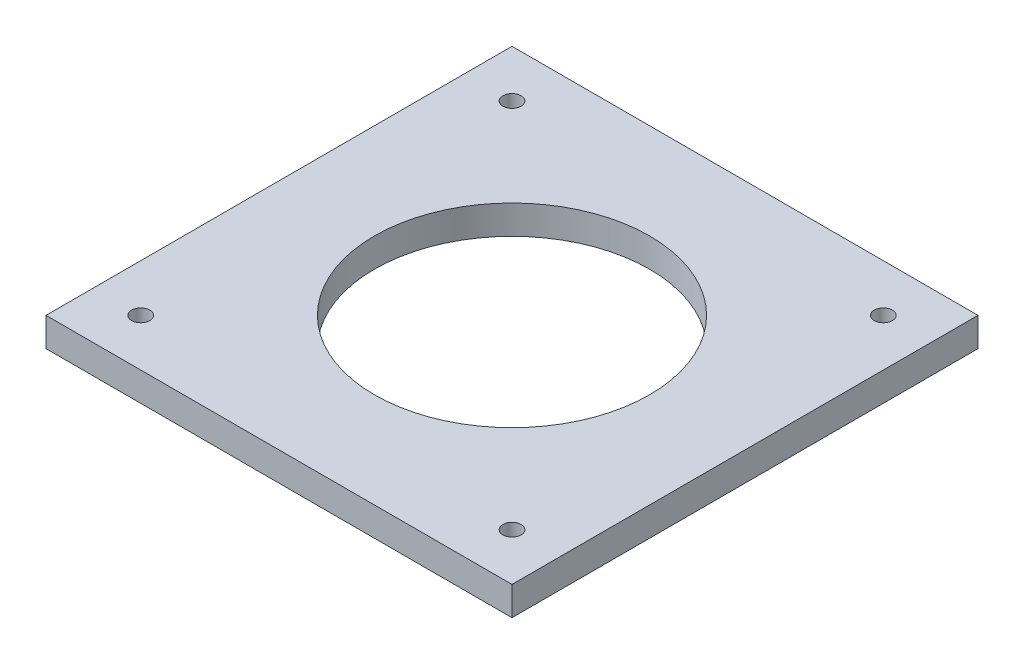
from build123d import *

# Parameters (mm, degrees)
SKETCH1_W           = 101.6
SKETCH1_H           = 101.6
SKETCH1_R           = 30
SKETCH1_R_2         = 1.985
BOSS_EXTRUDE1_DEPTH = 6.29


with BuildPart() as part:
    # Sketch1 → Boss-Extrude1 (new body)
    with BuildSketch(Plane(origin=(0, 0, 0), x_dir=(1, 0, 0), z_dir=(0, 1, 0))):
        Rectangle(SKETCH1_W, SKETCH1_H)
        with Locations(Location((0, 0, 0), (0, 0, 270))):
            Circle(SKETCH1_R, mode=Mode.SUBTRACT)
        with Locations(Location((-40.48, 40.48, 0), (0, 0, 270))):
            Circle(SKETCH1_R_2, mode=Mode.SUBTRACT)
        with Locations(Location((40.48, 40.48, 0), (0, 0, 270))):
            Circle(SKETCH1_R_2, mode=Mode.SUBTRACT)
        with Locations(Location((40.48, -40.48, 0), (0, 0, 270))):
            Circle(SKETCH1_R_2, mode=Mode.SUBTRACT)
        with Locations(Location((-40.48, -40.48, 0), (0, 0, 270))):
            Circle(SKETCH1_R_2, mode=Mode.SUBTRACT)
    extrude(amount=BOSS_EXTRUDE1_DEPTH)


solid = part.part
